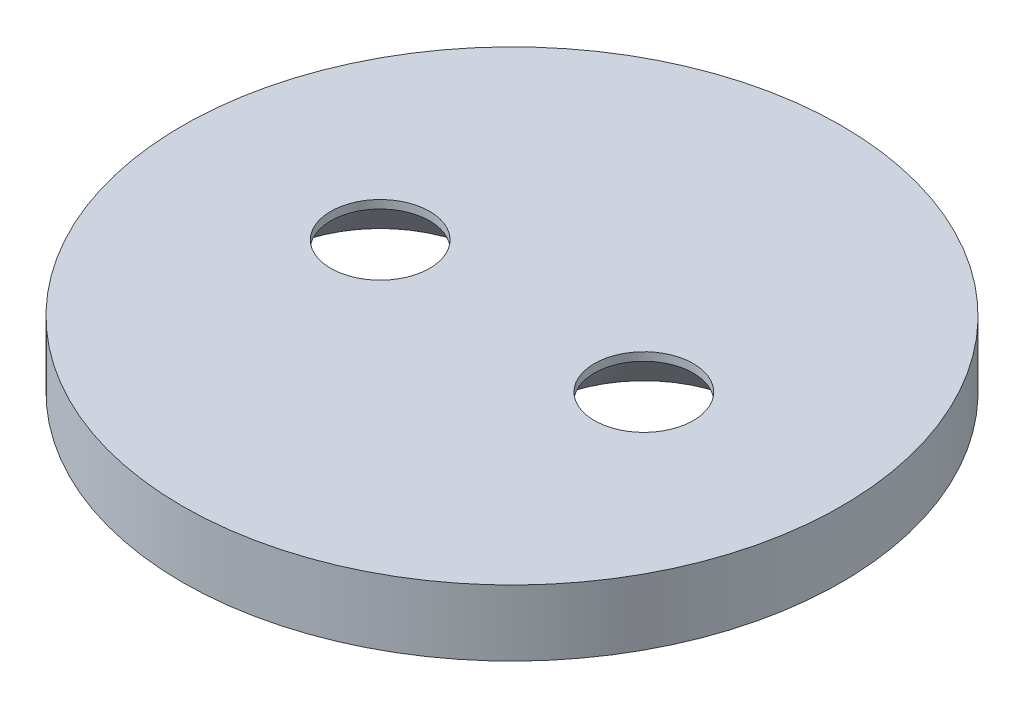
from build123d import *

# Parameters (mm, degrees)
SKETCH_1_R               = 10
EXTRUDE_1_DEPTH          = 2
HOLE_WIZARD_2_AT_2_COUNT = 2
HOLE_WIZARD_2_AT_2_PITCH = 8


with BuildPart() as part:
    # 草图1 → 凸台-拉伸1 (new body)
    with BuildSketch(Plane(origin=(0, 0, 0), x_dir=(1, 0, 0), z_dir=(0, 1, 0))):
        with Locations(Location((0, 0, 0), (0, 0, 270))):
            Circle(SKETCH_1_R)
    extrude(amount=EXTRUDE_1_DEPTH)

    # 草图4 → 孔2 (revolve, cut)
    with BuildSketch(Plane(origin=(4, 0, 0), x_dir=(0, 0, -1), z_dir=(1, 0, 0))):
        Polygon((0, 0), (0, 2), (1.5, 2), (1.5, 1.75), (3.25, 0), align=None)
    hole_wizard_2 = revolve(axis=Axis((4, -6.445314094, 0), (0, 1, 0)), mode=Mode.SUBTRACT)

    # 孔2 at 2: 孔2 ×2
    with Locations(*[(-i * HOLE_WIZARD_2_AT_2_PITCH, 0, 0) for i in range(1, HOLE_WIZARD_2_AT_2_COUNT)]):
        add(hole_wizard_2, mode=Mode.SUBTRACT)


solid = part.part
